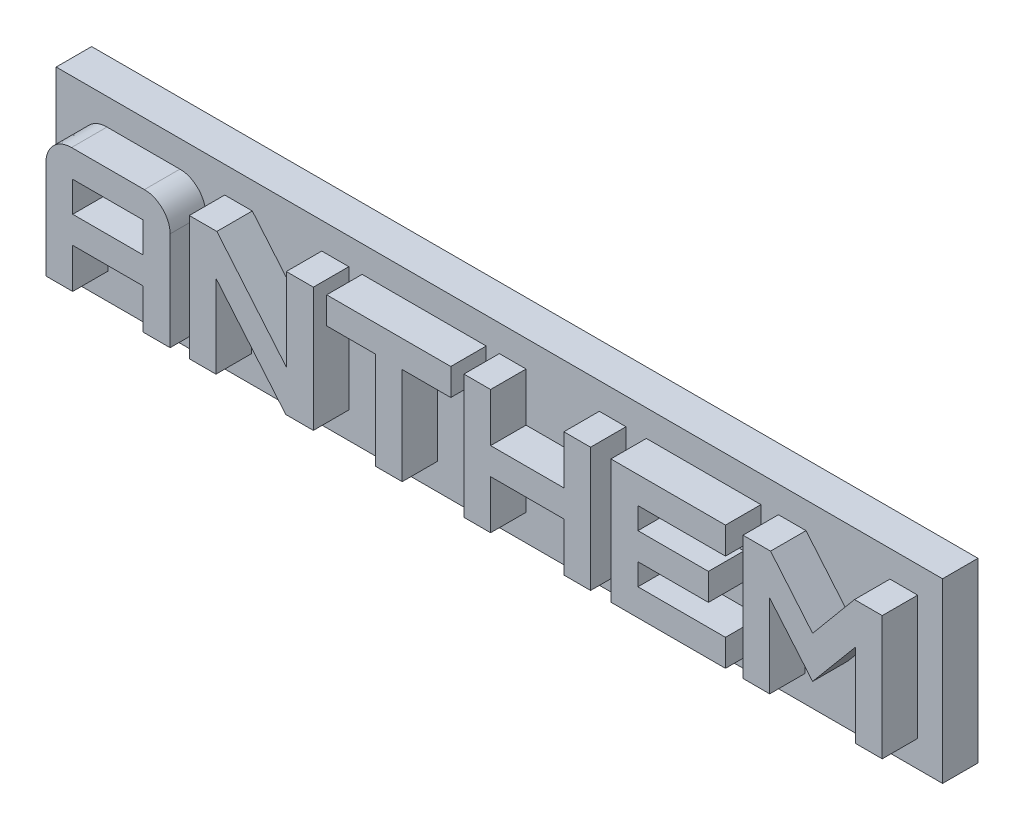
from build123d import *

# Parameters (mm, degrees)
SKETCH1_W             = 1.983122363
SKETCH1_H             = 0.855133615
BOSS_EXTRUDE1_DEPTH   = 1
BOSS_EXTRUDE1_2_DEPTH = 1
BOSS_EXTRUDE1_3_DEPTH = 1
BOSS_EXTRUDE1_4_DEPTH = 1
BOSS_EXTRUDE1_5_DEPTH = 1
BOSS_EXTRUDE1_6_DEPTH = 1
SKETCH2_W             = 25
SKETCH2_H             = 5
BOSS_EXTRUDE2_DEPTH   = 1


with BuildPart() as part:
    # Sketch1 → Boss-Extrude1 (new body)
    with BuildSketch(Plane.XY):
        with BuildLine():
            Line((0.281997187, 0), (0.281997187, 2.780590717))
            add(Edge.make_bspline(
                [(0.281997187, 2.780590717), (0.283229244, 2.813026758), (0.285659888, 2.87701767), (0.304480904, 2.970500865), (0.334977853, 3.059415163), (0.377200617, 3.143135369), (0.43021619, 3.220013944), (0.490517367, 3.290502947), (0.560613021, 3.351341498), (0.637677118, 3.403898535), (0.721142214, 3.447362774), (0.810633683, 3.477327555), (0.904491397, 3.4964233), (0.968729628, 3.498794045), (1.00140647, 3.5)],
                knots=[0, 0, 0, 0, 1.032830424, 2.037602572, 3.024846489, 4.020164832, 5.014473951, 5.993861653, 6.967623515, 7.961932634, 8.960635615, 9.954944734, 10.959716882, 12, 12, 12, 12], degree=3))
            Line((1.00140647, 3.5), (3.05766526, 3.5))
            add(Edge.make_bspline(
                [(3.05766526, 3.5), (3.090103466, 3.498772386), (3.154098648, 3.496350507), (3.247550665, 3.477465492), (3.336681955, 3.447172624), (3.420051858, 3.403984292), (3.497130942, 3.350888644), (3.568573893, 3.290836996), (3.629457878, 3.219800158), (3.684008122, 3.143247784), (3.727453764, 3.059458406), (3.75985444, 2.970775725), (3.778237993, 2.876986116), (3.780732672, 2.813016144), (3.781997187, 2.780590717)],
                knots=[0, 0, 0, 0, 1.0309459, 2.033884719, 3.019327289, 4.016208014, 5.008702895, 5.991943608, 6.974449273, 7.975419069, 8.975722404, 9.966115281, 10.9690541, 12, 12, 12, 12], degree=3))
            Line((3.781997187, 2.780590717), (3.781997187, 0))
            Line((3.781997187, 0), (3.018284107, 0))
            Line((3.018284107, 0), (3.018284107, 1.127988748))
            Line((3.018284107, 1.127988748), (1.035161744, 1.127988748))
            Line((1.035161744, 1.127988748), (1.035161744, 0))
            Line((1.035161744, 0), (0.281997187, 0))
        make_face()
        with Locations((2.026722926, 2.313642757)):
            Rectangle(SKETCH1_W, SKETCH1_H, mode=Mode.SUBTRACT)
    extrude(amount=BOSS_EXTRUDE1_DEPTH)



with BuildPart() as body_2:
    # Sketch1 → Boss-Extrude1 2 (new body)
    with BuildSketch(Plane.XY):
        Polygon((4.32278481, 0), (4.32278481, 3.5), (5.100562588, 3.5), (7.059774965, 1.166666667), (7.059774965, 3.5), (7.82278481, 3.5), (7.82278481, 0), (7.045007032, 0), (5.075949367, 2.343178622), (5.075949367, 0), align=None)
    extrude(amount=BOSS_EXTRUDE1_2_DEPTH)


with BuildPart() as body_3:
    # Sketch1 → Boss-Extrude1 3 (new body)
    with BuildSketch(Plane.XY):
        Polygon((9.568917018, 0), (9.568917018, 2.741209564), (8.198312236, 2.741209564), (8.198312236, 3.5), (11.698312236, 3.5), (11.698312236, 2.741209564), (10.327707454, 2.741209564), (10.327707454, 0), align=None)
    extrude(amount=BOSS_EXTRUDE1_3_DEPTH)


with BuildPart() as body_4:
    # Sketch1 → Boss-Extrude1 4 (new body)
    with BuildSketch(Plane.XY):
        Polygon((12.068917018, 0), (12.068917018, 3.5), (12.822081575, 3.5), (12.822081575, 2.128691983), (14.888185654, 2.128691983), (14.888185654, 3.5), (15.641350211, 3.5), (15.641350211, 0), (14.888185654, 0), (14.888185654, 1.370604782), (12.822081575, 1.370604782), (12.822081575, 0), align=None)
    extrude(amount=BOSS_EXTRUDE1_4_DEPTH)


with BuildPart() as body_5:
    # Sketch1 → Boss-Extrude1 5 (new body)
    with BuildSketch(Plane.XY):
        Polygon((16.214486639, 0), (16.214486639, 3.5), (19.446554149, 3.5), (19.446554149, 2.741209564), (16.977496484, 2.741209564), (16.977496484, 2.128691983), (18.965541491, 2.128691983), (18.965541491, 1.370604782), (16.977496484, 1.370604782), (16.977496484, 0.758087201), (19.446554149, 0.758087201), (19.446554149, 0), align=None)
    extrude(amount=BOSS_EXTRUDE1_5_DEPTH)


with BuildPart() as body_6:
    # Sketch1 → Boss-Extrude1 6 (new body)
    with BuildSketch(Plane.XY):
        Polygon((19.940225035, 0), (19.940225035, 3.5), (20.718002813, 3.5), (21.904360056, 2.085091421), (23.085091421, 3.5), (23.867791842, 3.5), (23.867791842, 0), (23.109704641, 0), (23.109704641, 2.347398031), (21.904360056, 0.9092827), (20.693389592, 2.343178622), (20.693389592, 0), align=None)
    extrude(amount=BOSS_EXTRUDE1_6_DEPTH)


with BuildPart() as part_1:
    add(part.part)

    add(body_2.part)  # Boss-Extrude2 merges body 2

    add(body_3.part)  # Boss-Extrude2 merges body 3

    add(body_4.part)  # Boss-Extrude2 merges body 4

    add(body_5.part)  # Boss-Extrude2 merges body 5

    add(body_6.part)  # Boss-Extrude2 merges body 6
    # Sketch2 → Boss-Extrude2 (add)
    with BuildSketch(Plane(origin=(0, 0, 0), x_dir=(-1, 0, 0), z_dir=(0, 0, -1))):
        with Locations((-12.068917018, 1.75)):
            Rectangle(SKETCH2_W, SKETCH2_H)
    extrude(amount=BOSS_EXTRUDE2_DEPTH)


solid = part_1.part
